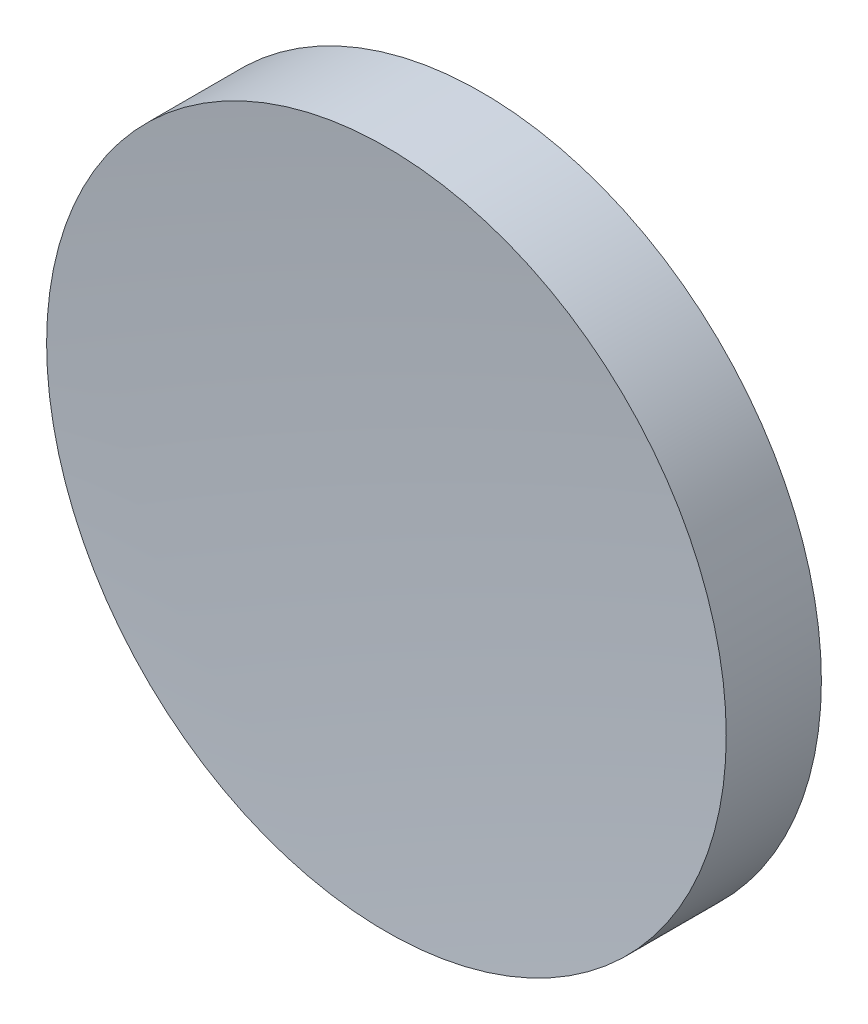
from build123d import *

# Parameters (mm, degrees)
ESQUISSE1_R        = 125
BOSS_EXTRU_1_DEPTH = 35


with BuildPart() as part:
    # Esquisse1 → Boss.-Extru.1 (new body)
    with BuildSketch(Plane.XY):
        Circle(ESQUISSE1_R)
    extrude(amount=BOSS_EXTRU_1_DEPTH)

    # Esquisse2 → Enlèvement de matière-Révolution6 (revolve, cut)
    with BuildSketch(Plane(origin=(0, 0, 0), x_dir=(1, 0, 0), z_dir=(0, 1, 0))):
        with BuildLine():
            Line((0, -1630.109714095), (0, -30.109714095))
            ThreePointArc((0, -30.109714095), (1131.370849898, -498.738864196), (1600, -1630.109714095))
            Line((1600, -1630.109714095), (0, -1630.109714095))
        make_face()
    revolve(axis=Axis((0, 0, 0), (0, 0, 1)), mode=Mode.SUBTRACT)


solid = part.part
